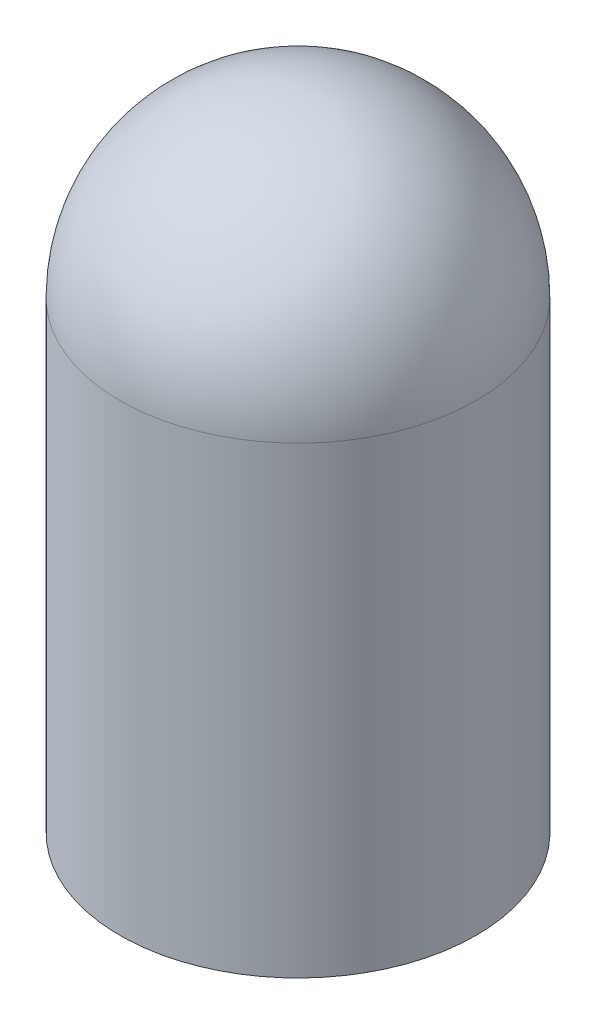
from build123d import *

# Parameters (mm, degrees)
SKETCH_1_W = 2.5
SKETCH_1_H = 6.5


with BuildPart() as part:
    # Эскиз1 → Повернуть1 (revolve)
    with BuildSketch(Plane.XY):
        with BuildLine():
            Line((0, 6.5), (2.5, 6.5))
            ThreePointArc((2.5, 6.5), (1.767766953, 8.267766953), (0, 9))
            Line((0, 9), (0, 6.5))
        make_face()
        with Locations((1.25, 3.25)):
            Rectangle(SKETCH_1_W, SKETCH_1_H)
    revolve(axis=Axis((0, 0, 0), (0, 1, 0)))


solid = part.part
